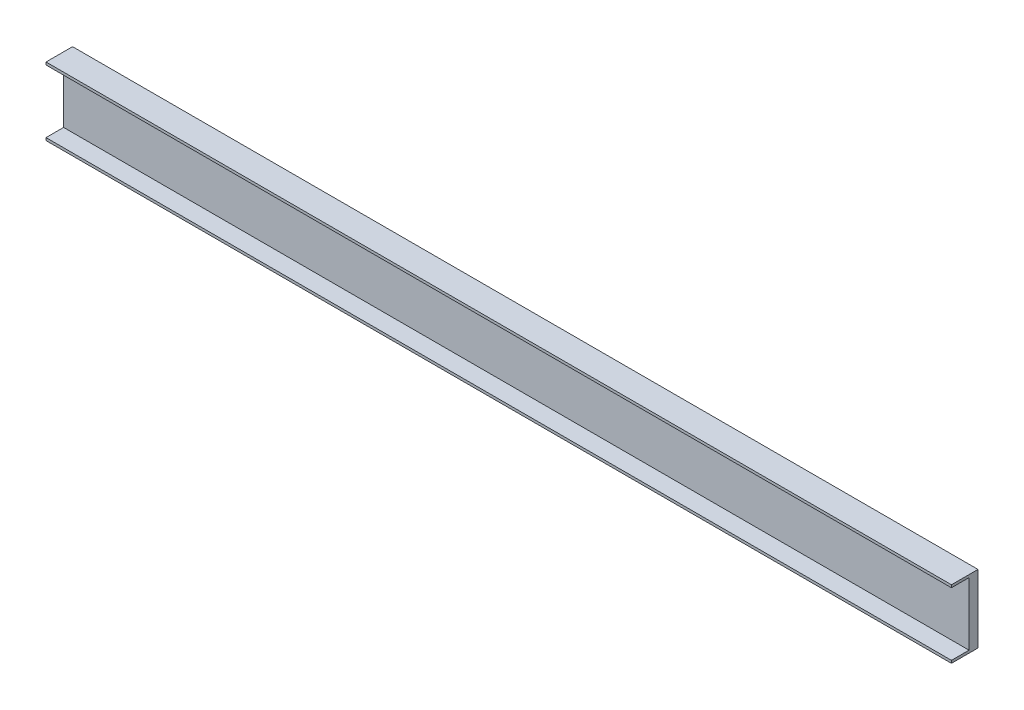
from build123d import *

# Parameters (mm, degrees)
SKETCH_1_W         = 3990
SKETCH_1_H         = 300
EXTRUDE_1314_DEPTH = 39.5
SKETCH_2_W         = 3990
SKETCH_2_H         = 11.5
EXTRUDE_1_DEPTH    = 77.5
SKETCH_3_W         = 70
SKETCH_3_H         = 230
EXTRUDE_2_DEPTH    = 16


with BuildPart() as part:
    # 草图1 → Extrude 1314 (new body)
    with BuildSketch(Plane.XY):
        Rectangle(SKETCH_1_W, SKETCH_1_H)
    extrude(amount=EXTRUDE_1314_DEPTH)

    # 草图2 → 凸台-拉伸1 (add)
    with BuildSketch(Plane.XY.offset(39.5)):
        with Locations((0, 144.25)):
            Rectangle(SKETCH_2_W, SKETCH_2_H)
        with Locations((0, -144.25)):
            Rectangle(SKETCH_2_W, SKETCH_2_H)
    extrude(amount=EXTRUDE_1_DEPTH)

    # 草图3 → 凸台-拉伸2 (add)
    with BuildSketch(Plane(origin=(0, 0, 0), x_dir=(-1, 0, 0), z_dir=(0, 0, -1))):
        with Locations((1300, 0)):
            Rectangle(SKETCH_3_W, SKETCH_3_H)
        with Locations((900, 0)):
            Rectangle(SKETCH_3_W, SKETCH_3_H)
        with Locations((-1300, 0)):
            Rectangle(SKETCH_3_W, SKETCH_3_H)
        with Locations((500, 0)):
            Rectangle(SKETCH_3_W, SKETCH_3_H)
        with Locations((-900, 0)):
            Rectangle(SKETCH_3_W, SKETCH_3_H)
        with Locations((-500, 0)):
            Rectangle(SKETCH_3_W, SKETCH_3_H)
    extrude(amount=EXTRUDE_2_DEPTH)


solid = part.part
